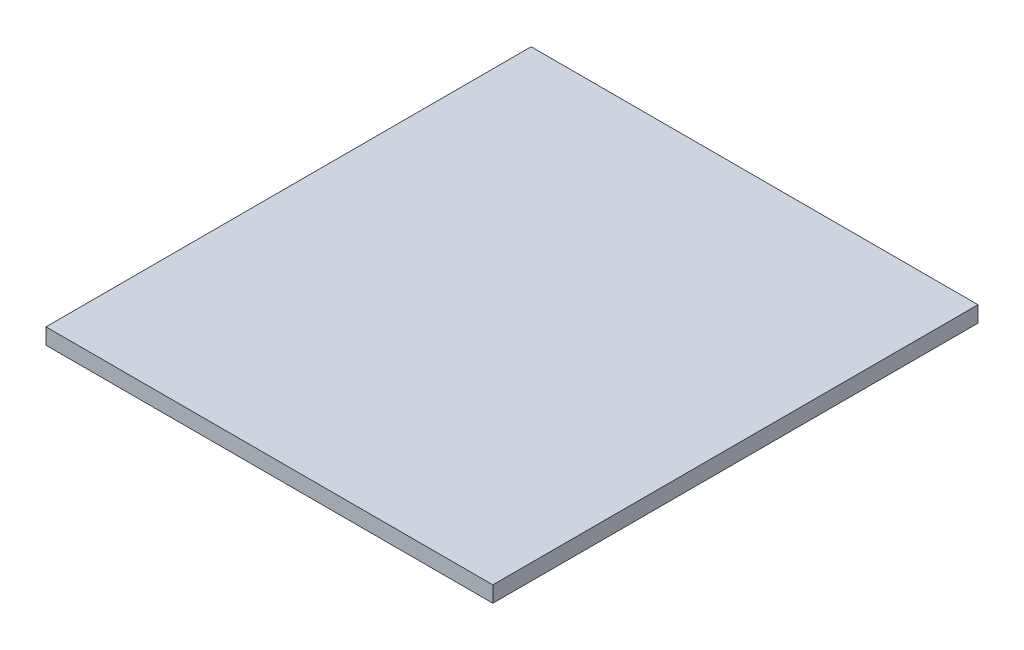
from build123d import *

# Parameters (mm, degrees)
SKETCH1_W           = 560
SKETCH1_H           = 608
BOSS_EXTRUDE1_DEPTH = 20


with BuildPart() as part:
    # Sketch1 → Boss-Extrude1 (new body)
    with BuildSketch(Plane(origin=(0, 0, 0), x_dir=(1, 0, 0), z_dir=(0, 1, 0))):
        Rectangle(SKETCH1_W, SKETCH1_H)
    extrude(amount=BOSS_EXTRUDE1_DEPTH)


solid = part.part
